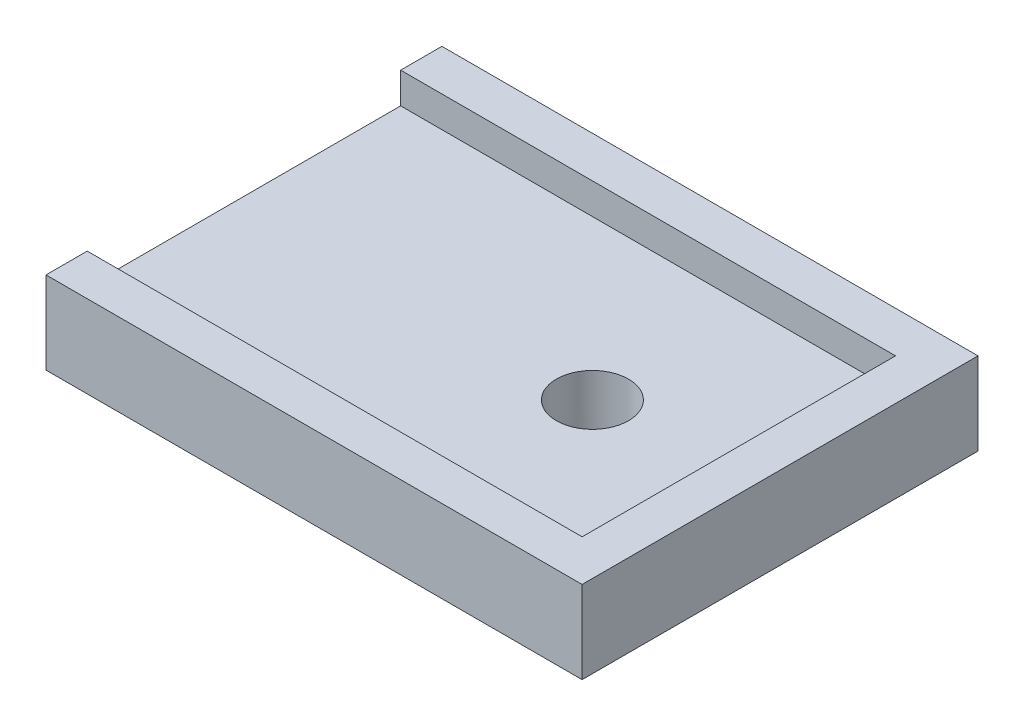
from build123d import *

# Parameters (mm, degrees)
SKETCH1_W           = 24
SKETCH1_H           = 15.2
BOSS_EXTRUDE1_DEPTH = 2.5
SKETCH3_R           = 1.75
CUT_EXTRUDE1_DEPTH  = 10
BOSS_EXTRUDE2_DEPTH = 4


with BuildPart() as part:
    # Sketch1 → Boss-Extrude1 (new body)
    with BuildSketch(Plane(origin=(0, 0, 0), x_dir=(1, 0, 0), z_dir=(0, 1, 0))):
        Rectangle(SKETCH1_W, SKETCH1_H)
    extrude(amount=BOSS_EXTRUDE1_DEPTH)

    # Sketch3 → Cut-Extrude1 (cut)
    with BuildSketch(Plane(origin=(0, 2.5, 0), x_dir=(1, 0, 0), z_dir=(0, 1, 0))):
        with Locations(Location((5, -0.1, 0), (0, 0, 270))):
            Circle(SKETCH3_R)
    extrude(amount=-CUT_EXTRUDE1_DEPTH, mode=Mode.SUBTRACT)

    # Sketch4 → Boss-Extrude2 (add)
    with BuildSketch(Plane(origin=(0, 0, 0), x_dir=(-1, 0, 0), z_dir=(0, -1, 0))):
        Polygon((12, -9.6), (12, -7.6), (-12, -7.6), (-12, 7.6), (12, 7.6), (12, 9.6), (-14, 9.6), (-14, -9.6), align=None)
    extrude(amount=-BOSS_EXTRUDE2_DEPTH)


solid = part.part
